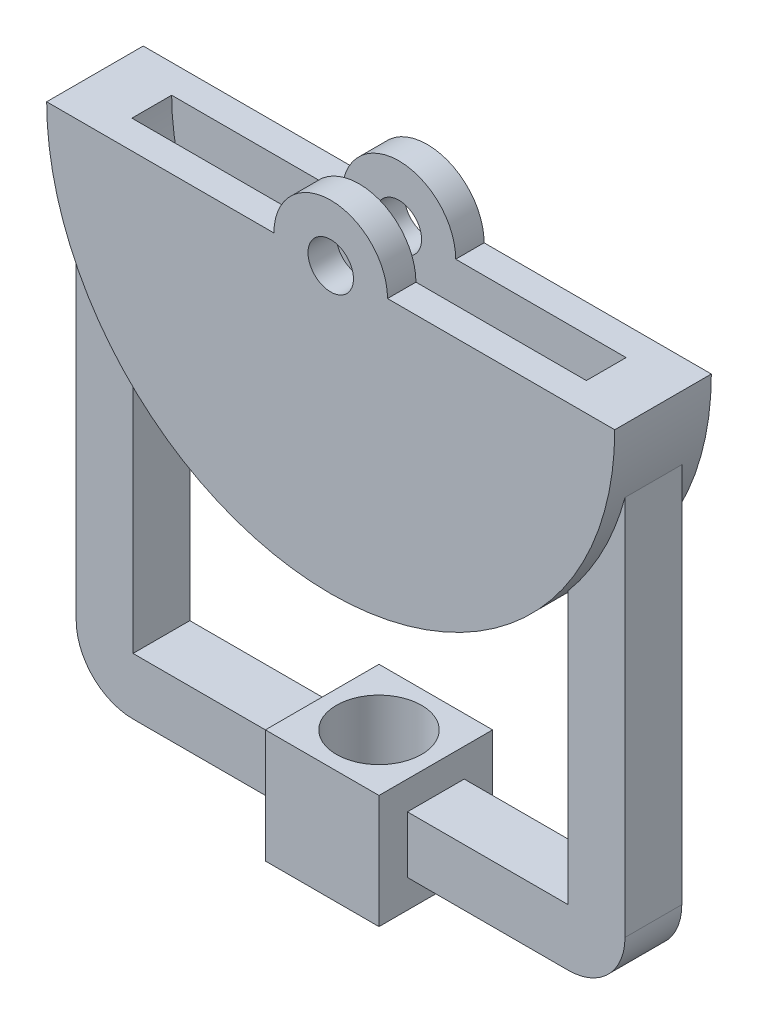
from build123d import *

# Parameters (mm, degrees)
SKETCH1_R           = 4
BOSS_EXTRUDE1_DEPTH = 5
BOSS_EXTRUDE2_DEPTH = 7
SKETCH3_R           = 4
BOSS_EXTRUDE3_DEPTH = 5
BOSS_EXTRUDE4_START = -13.5
BOSS_EXTRUDE4_DEPTH = 10
FILLET1_R           = 10
SKETCH7_W           = 20
SKETCH7_H           = 20
BOSS_EXTRUDE6_DEPTH = 20
SKETCH8_R           = 7.5
CUT_EXTRUDE2_DEPTH  = 20


with BuildPart() as part:
    # Sketch1 → Boss-Extrude1 (new body)
    with BuildSketch(Plane.XY):
        with BuildLine():
            Line((-50, 0), (-10, 0))
            ThreePointArc((-10, 0), (0, 10), (10, 0))
            Line((10, 0), (50, 0))
            ThreePointArc((50, 0), (0, -50), (-50, 0))
        make_face()
        Circle(SKETCH1_R, mode=Mode.SUBTRACT)
    extrude(amount=BOSS_EXTRUDE1_DEPTH)

    # Sketch2 → Boss-Extrude2 (add)
    with BuildSketch(Plane.XY.offset(5)):
        with BuildLine():
            Line((-50, 0), (-40, 0))
            ThreePointArc((-40, 0), (0, -40), (40, 0))
            Line((40, 0), (50, 0))
            ThreePointArc((50, 0), (0, -50), (-50, 0))
        make_face()
    extrude(amount=BOSS_EXTRUDE2_DEPTH)

    # Sketch3 → Boss-Extrude3 (add)
    with BuildSketch(Plane.XY.offset(12)):
        with BuildLine():
            Line((-50, 0), (-10, 0))
            ThreePointArc((-10, 0), (0, 10), (10, 0))
            Line((10, 0), (50, 0))
            ThreePointArc((50, 0), (0, -50), (-50, 0))
        make_face()
        Circle(SKETCH3_R, mode=Mode.SUBTRACT)
    extrude(amount=BOSS_EXTRUDE3_DEPTH)

    # Sketch4 → Boss-Extrude4 (add)
    with BuildSketch(Plane.XY.offset(17).offset(BOSS_EXTRUDE4_START)):
        with BuildLine():
            Line((-10, -95), (10, -95))
            Line((10, -95), (10, -90))
            Line((10, -90), (48.299537742, -90))
            Line((48.299537742, -90), (48.299537742, -12.928830338))
            ThreePointArc((48.299537742, -12.928830338), (44.35247464, -23.08371706), (38.299537742, -32.142579373))
            Line((38.299537742, -32.142579373), (38.299537742, -80))
            Line((38.299537742, -80), (10, -80))
            Line((10, -80), (10, -75))
            Line((10, -75), (-10, -75))
            Line((-10, -75), (-10, -80))
            Line((-10, -80), (-38.299537742, -80))
            Line((-38.299537742, -80), (-38.299537742, -32.142579373))
            ThreePointArc((-38.299537742, -32.142579373), (-44.35247464, -23.08371706), (-48.299537742, -12.928830338))
            Line((-48.299537742, -12.928830338), (-48.299537742, -90))
            Line((-48.299537742, -90), (-10, -90))
            Line((-10, -90), (-10, -95))
        make_face()
    extrude(amount=BOSS_EXTRUDE4_DEPTH)

    # Fillet1
    fillet1_edges = [part.edges().sort_by_distance(p)[0] for p in [
        (48.299537742, -90, 8.5),
        (-48.299537742, -90, 8.5),
    ]]
    fillet(fillet1_edges, radius=FILLET1_R)

    # Sketch7 → Boss-Extrude6 (add)
    with BuildSketch(Plane.XZ.offset(95)):
        with Locations((0, 8.5)):
            Rectangle(SKETCH7_W, SKETCH7_H)
    extrude(amount=-BOSS_EXTRUDE6_DEPTH)

    # Sketch8 → Cut-Extrude2 (cut)
    with BuildSketch(Plane.XZ.offset(95)):
        with Locations(Location((0, 8.5, 0), (0, 0, 270))):
            Circle(SKETCH8_R)
    extrude(amount=-CUT_EXTRUDE2_DEPTH, mode=Mode.SUBTRACT)


solid = part.part
